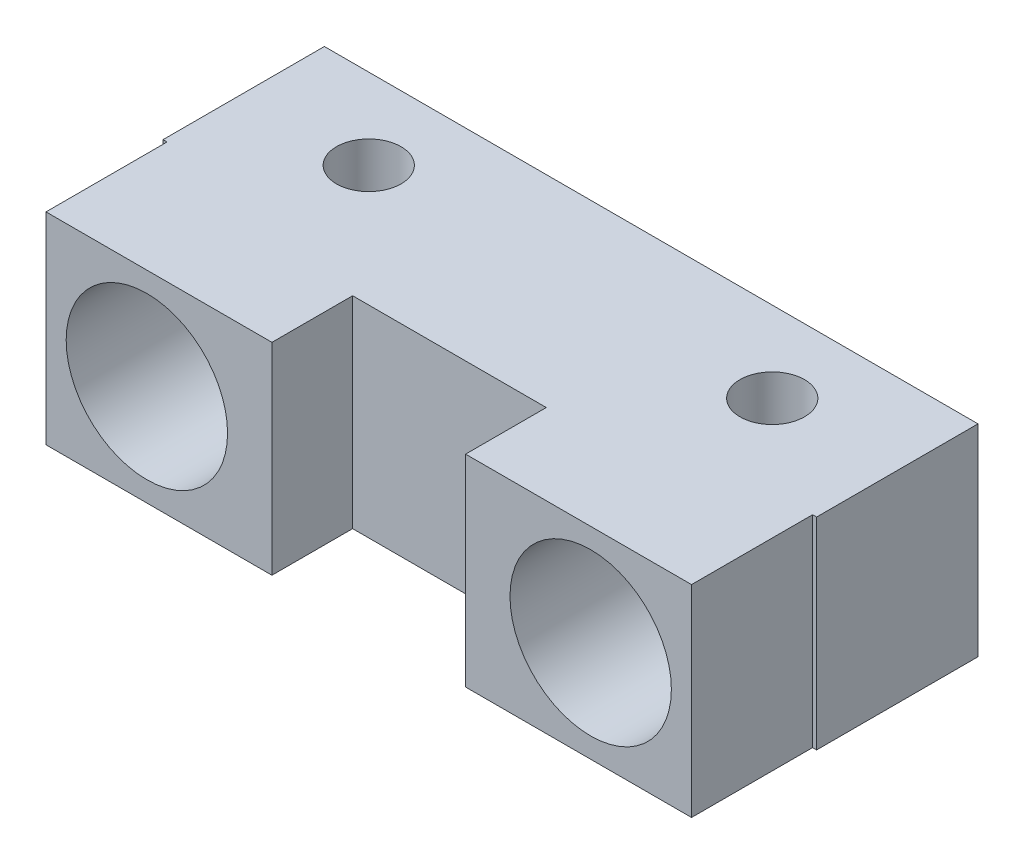
from build123d import *

# Parameters (mm, degrees)
SKETCH1_R           = 4
BOSS_EXTRUDE1_DEPTH = 12.5
SKETCH2_R           = 10
CUT_EXTRUDE1_DEPTH  = 15
SKETCH3_W           = 24
SKETCH3_H           = 31
CUT_EXTRUDE2_DEPTH  = 10


with BuildPart() as part:
    # Sketch1 → Boss-Extrude1 (new, symmetric)
    with BuildSketch(Plane(origin=(0, 0, 0), x_dir=(1, 0, 0), z_dir=(0, 1, 0))):
        Polygon((-40.5, -10), (-40, -10), (-40, -25), (40, -25), (40, -10), (40.5, -10), (40.5, 10), (-40.5, 10), align=None)
        with Locations(Location((-25, 0, 0), (0, 0, 270))):
            Circle(SKETCH1_R, mode=Mode.SUBTRACT)
        with Locations(Location((25, 0, 0), (0, 0, 90))):
            Circle(SKETCH1_R, mode=Mode.SUBTRACT)
    extrude(amount=BOSS_EXTRUDE1_DEPTH, both=True)

    # Sketch2 → Cut-Extrude1 (cut)
    with BuildSketch(Plane.XY.offset(25)):
        with Locations((-27.5, 0)):
            Circle(SKETCH2_R)
        with Locations(Location((27.5, 0, 0), (0, 0, 180))):
            Circle(SKETCH2_R)
    extrude(amount=-CUT_EXTRUDE1_DEPTH, mode=Mode.SUBTRACT)

    # Sketch3 → Cut-Extrude2 (cut)
    with BuildSketch(Plane.XY.offset(25)):
        Rectangle(SKETCH3_W, SKETCH3_H)
    extrude(amount=-CUT_EXTRUDE2_DEPTH, mode=Mode.SUBTRACT)


solid = part.part
